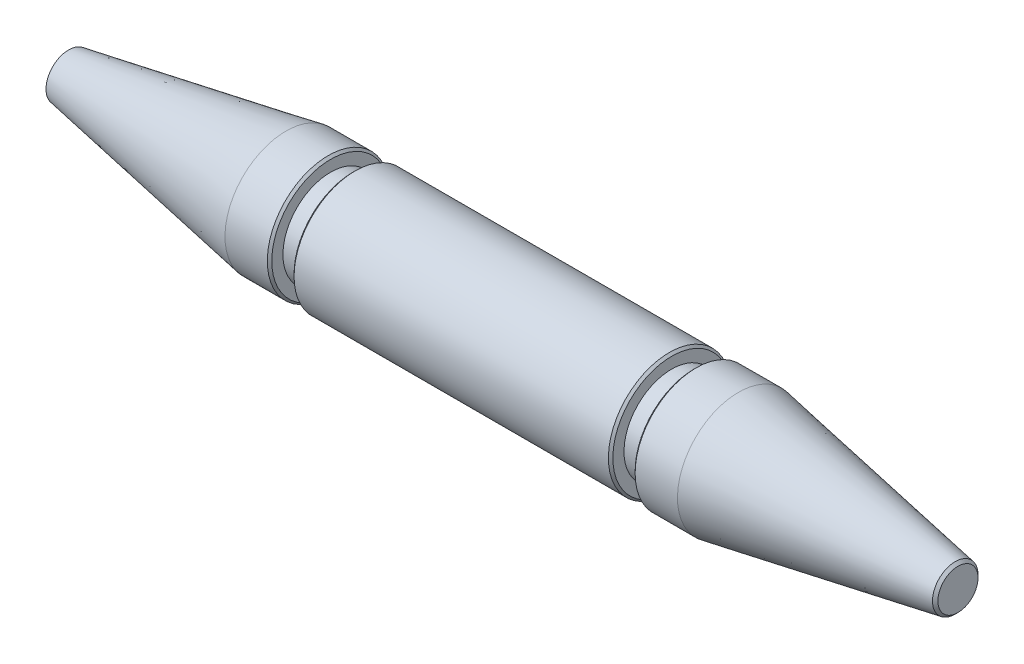
from build123d import *
from OCP.BRepFilletAPI import BRepFilletAPI_MakeChamfer

# Parameters (mm, degrees)
CHAMFER_1_SIZE  = 0.5
CHAMFER_1_SIZE2 = 0.616401526


with BuildPart() as part:
    # 草图1 → 旋转1 (revolve)
    with BuildSketch(Plane.XY, mode=Mode.PRIVATE) as revolve_1_sk:
        Polygon((-100, 0), (100, 0), (100, 5), (50.759612349, 13.682408883), (40.759612349, 13.682408883), (40.759612349, 10.682408883), (35.759612349, 10.682408883), (35.759612349, 13.682408883), (-35.759612349, 13.682408883), (-35.759612349, 10.682408883), (-40.759612349, 10.682408883), (-40.759612349, 13.682408883), (-50.759612349, 13.682408883), (-100, 5), align=None)
    revolve(revolve_1_sk.sketch.rotate(Axis((-100, 0, 0), (1, 0, 0)), 180), axis=Axis((-100, 0, 0), (1, 0, 0)))

    # 倒角1: one chamfer whose edges measure the first distance from different faces: ONE call of the kernel's chamfer builder (chamfer() names one face for all edges)
    chamfer_1_edges_1 = [part.edges().sort_by_distance(p)[0] for p in [
        (100, 5, 0),
    ]]
    chamfer_1_side_1 = [part.faces().sort_by_distance(p)[0] for p in [
        (100, 0, 0),
    ]]
    chamfer_1_edges_2 = [part.edges().sort_by_distance(p)[0] for p in [
        (40.759612349, 13.682408883, 0),
        (35.759612349, 13.682408883, 0),
        (-35.759612349, 13.682408883, 0),
        (-40.759612349, 13.682408883, 0),
    ]]
    chamfer_1_edges_3 = [part.edges().sort_by_distance(p)[0] for p in [
        (-100, 5, 0),
    ]]
    chamfer_1_side_3 = [part.faces().sort_by_distance(p)[0] for p in [
        (-75.379806175, 9.341204442, 0),
    ]]
    chamfer_1 = BRepFilletAPI_MakeChamfer(part.part.solid().wrapped)
    for e in chamfer_1_edges_1:
        chamfer_1.Add(CHAMFER_1_SIZE, CHAMFER_1_SIZE2, e.wrapped, chamfer_1_side_1[0].wrapped)  # the first distance lies on this face
    for e in chamfer_1_edges_2:
        chamfer_1.Add(CHAMFER_1_SIZE, e.wrapped)
    for e in chamfer_1_edges_3:
        chamfer_1.Add(CHAMFER_1_SIZE, CHAMFER_1_SIZE2, e.wrapped, chamfer_1_side_3[0].wrapped)  # the first distance lies on this face
    add(Compound.cast(chamfer_1.Shape()), mode=Mode.REPLACE)


solid = part.part
